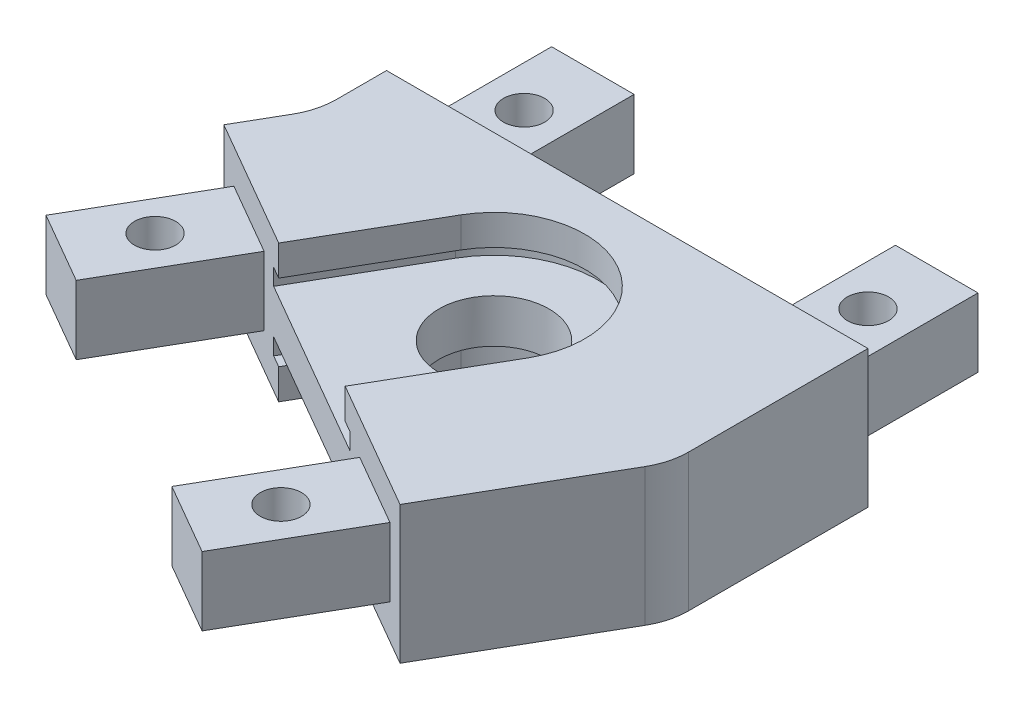
from build123d import *

# Parameters (mm, degrees)
SKETCH1_R           = 1.5
BOSS_EXTRUDE1_DEPTH = 5
BOSS_EXTRUDE2_DEPTH = 2.5
BOSS_EXTRUDE3_DEPTH = 2.5
SKETCH6_R           = 7.6
CUT_EXTRUDE1_DEPTH  = 1.2
SKETCH8_R           = 6.6
CUT_EXTRUDE2_DEPTH  = 56.938163239
CUT_EXTRUDE5_START  = -9.689111
CUT_EXTRUDE5_DEPTH  = 9.689111
FILLET1_R           = 5
SKETCH9_R           = 4
CUT_EXTRUDE6_DEPTH  = 56.783708254


with BuildPart() as part:
    # Sketch1 → Boss-Extrude1 (new body)
    with BuildSketch(Plane(origin=(0, 0, 0), x_dir=(1, 0, 0), z_dir=(0, 1, 0))):
        Polygon((0, 0), (6, 0), (6, -10), (25, -10), (25, 0), (31, 0), (31, -10), (33, -10), (33, -24.378221735), (25.810889132, -36.830127019), (24.078838325, -35.830127019), (19.078838325, -44.490381057), (13.882685902, -41.490381057), (18.882685902, -32.830127019), (2.42820323, -23.330127019), (-2.57179677, -31.990381057), (-7.767949192, -28.990381057), (-2.767949192, -20.330127019), (-4.5, -19.330127019), (-2, -15), (-2, -10), (0, -10), align=None)
        with Locations(Location((3, -5, 0), (0, 0, 270))):
            Circle(SKETCH1_R, mode=Mode.SUBTRACT)
        with Locations(Location((28, -5, 0), (0, 0, 90))):
            Circle(SKETCH1_R, mode=Mode.SUBTRACT)
        with Locations(Location((-2.669872981, -26.160254038, 0), (0, 0, 270))):
            Circle(SKETCH1_R, mode=Mode.SUBTRACT)
        with Locations(Location((18.980762114, -38.660254038, 0), (0, 0, 270))):
            Circle(SKETCH1_R, mode=Mode.SUBTRACT)
    extrude(amount=BOSS_EXTRUDE1_DEPTH)

    # Sketch2 → Boss-Extrude2 (add)
    with BuildSketch(Plane(origin=(0, 5, 0), x_dir=(1, 0, 0), z_dir=(0, 1, 0))):
        Polygon((-2, -10), (33, -10), (33, -24.378221735), (25.810889132, -36.830127019), (-4.5, -19.330127019), (-2, -15), align=None)
    extrude(amount=BOSS_EXTRUDE2_DEPTH)

    # Sketch3 → Boss-Extrude3 (add)
    with BuildSketch(Plane.XZ):
        Polygon((-2, 10), (33, 10), (33, 24.378221735), (25.810889132, 36.830127019), (-4.5, 19.330127019), (-2, 15), align=None)
    extrude(amount=BOSS_EXTRUDE3_DEPTH)

    # Sketch6 → Cut-Extrude1 (cut)
    with BuildSketch(Plane(origin=(0, 4.09, 0), x_dir=(1, 0, 0), z_dir=(0, 1, 0))):
        with Locations(Location((15.5, -19.689110868, 0), (0, 0, 270))):
            Circle(SKETCH6_R)
    cut_extrude1 = extrude(amount=CUT_EXTRUDE1_DEPTH, mode=Mode.SUBTRACT)

    # Sketch8 → Cut-Extrude2 (cut, through all)
    with BuildSketch(Plane(origin=(0, 5.29, 0), x_dir=(1, 0, 0), z_dir=(0, 1, 0))):
        with Locations(Location((15.5, -19.689110868, 0), (0, 0, 270))):
            Circle(SKETCH8_R)
    cut_extrude2 = extrude(amount=CUT_EXTRUDE2_DEPTH, mode=Mode.SUBTRACT)

    # Sketch5 → Cut-Extrude5 (cut)
    with BuildSketch(Plane(origin=(-9.495190528, 0, 16.446152423), x_dir=(0.8660254037844386, 0, 0.5000000000000003), z_dir=(-0.5000000000000003, 0, 0.8660254037844386)).offset(CUT_EXTRUDE5_START)):
        Polygon((16.667949192, 7.5), (16.667949192, 5.29), (15.667949192, 5.29), (15.667949192, 4.09), (23.267949192, 4.09), (30.867949192, 4.09), (30.867949192, 5.29), (29.867949192, 5.29), (29.867949192, 7.5), align=None)
    cut_extrude5 = extrude(amount=CUT_EXTRUDE5_DEPTH, mode=Mode.SUBTRACT)

    # Mirror1: Cut-Extrude1, Cut-Extrude2, Cut-Extrude5 across plane
    add(cut_extrude1.mirror(Plane.ZX.offset(2.5)), mode=Mode.SUBTRACT)
    add(cut_extrude2.mirror(Plane.ZX.offset(2.5)), mode=Mode.SUBTRACT)
    add(cut_extrude5.mirror(Plane.ZX.offset(2.5)), mode=Mode.SUBTRACT)

    # Fillet1
    fillet1_edges = [part.edges().sort_by_distance(p)[0] for p in [
        (33, 2.5, 24.378221735),
        (-2, 2.5, 15),
    ]]
    fillet(fillet1_edges, radius=FILLET1_R)

    # Sketch9 → Cut-Extrude6 (cut, through all)
    with BuildSketch(Plane(origin=(0, 4.09, 0), x_dir=(1, 0, 0), z_dir=(0, 1, 0))):
        with Locations(Location((15.5, -19.689110868, 0), (0, 0, 270))):
            Circle(SKETCH9_R)
    extrude(amount=-CUT_EXTRUDE6_DEPTH, mode=Mode.SUBTRACT)


solid = part.part
